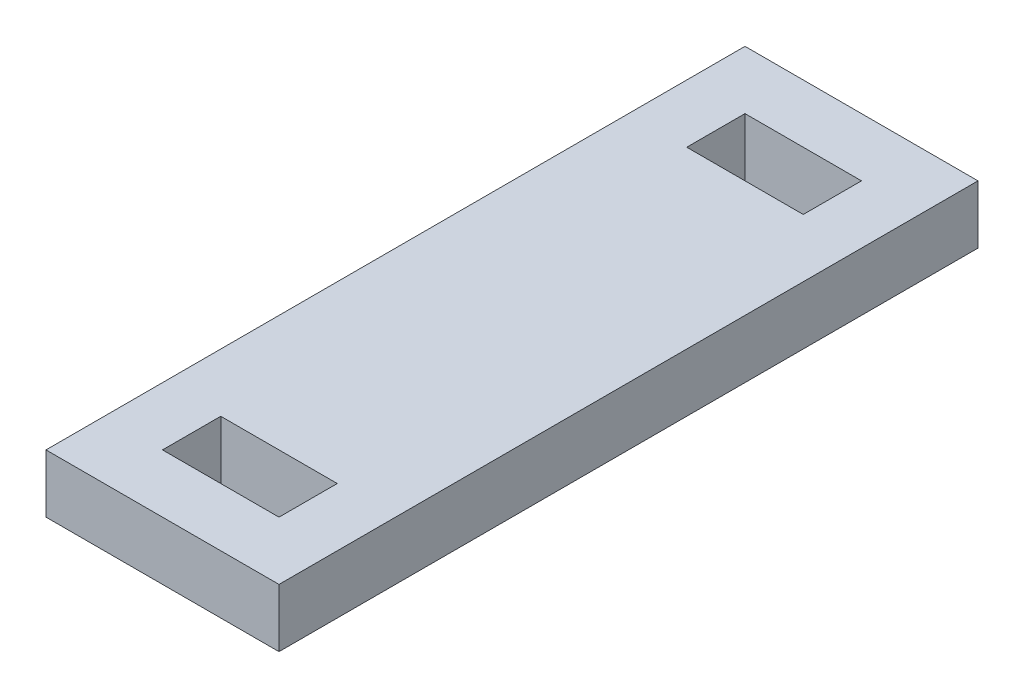
from build123d import *

# Parameters (mm, degrees)
SKETCH1_W           = 20
SKETCH1_H           = 60
SKETCH1_W_2         = 10
SKETCH1_H_2         = 5
BOSS_EXTRUDE1_DEPTH = 5


with BuildPart() as part:
    # Sketch1 → Boss-Extrude1 (new body)
    with BuildSketch(Plane(origin=(0, 0, 0), x_dir=(1, 0, 0), z_dir=(0, 1, 0))):
        with Locations((-3.481481481, 49.433703704)):
            Rectangle(SKETCH1_W, SKETCH1_H)
        with Locations((-3.481481481, 26.933703704)):
            Rectangle(SKETCH1_W_2, SKETCH1_H_2, mode=Mode.SUBTRACT)
        with Locations((-3.481481481, 71.933703704)):
            Rectangle(SKETCH1_W_2, SKETCH1_H_2, mode=Mode.SUBTRACT)
    extrude(amount=BOSS_EXTRUDE1_DEPTH)


solid = part.part
